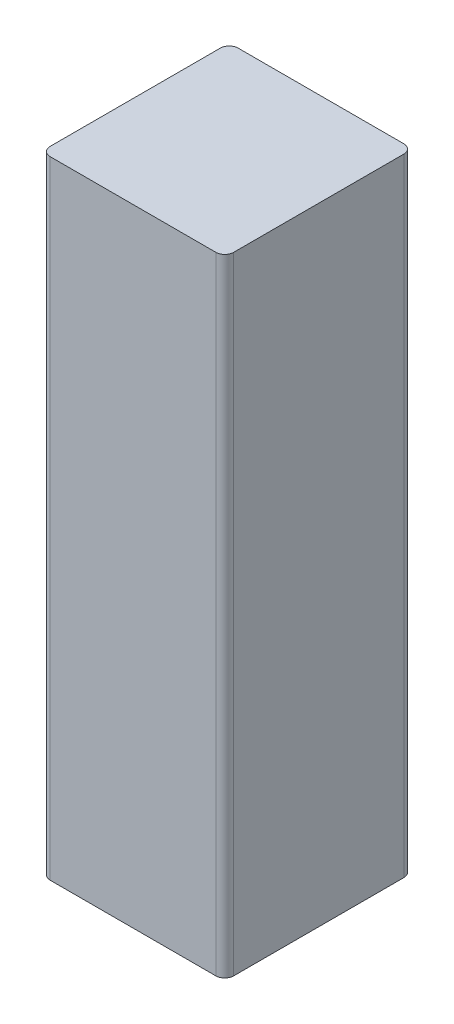
from build123d import *

# Parameters (mm, degrees)
BOSS_EXTRUDE1_DEPTH = 140


with BuildPart() as part:
    # Sketch1 → Boss-Extrude1 (new body)
    with BuildSketch(Plane(origin=(0, 0, 0), x_dir=(1, 0, 0), z_dir=(0, 1, 0))):
        with BuildLine():
            Line((18.5, -21), (-18.5, -21))
            ThreePointArc((-18.5, -21), (-19.914213562, -20.414213562), (-20.5, -19))
            Line((-20.5, -19), (-20.5, 19))
            ThreePointArc((-20.5, 19), (-19.914213562, 20.414213562), (-18.5, 21))
            Line((-18.5, 21), (18.5, 21))
            ThreePointArc((18.5, 21), (19.914213562, 20.414213562), (20.5, 19))
            Line((20.5, 19), (20.5, -19))
            ThreePointArc((20.5, -19), (19.914213562, -20.414213562), (18.5, -21))
        make_face()
    extrude(amount=BOSS_EXTRUDE1_DEPTH)


solid = part.part
